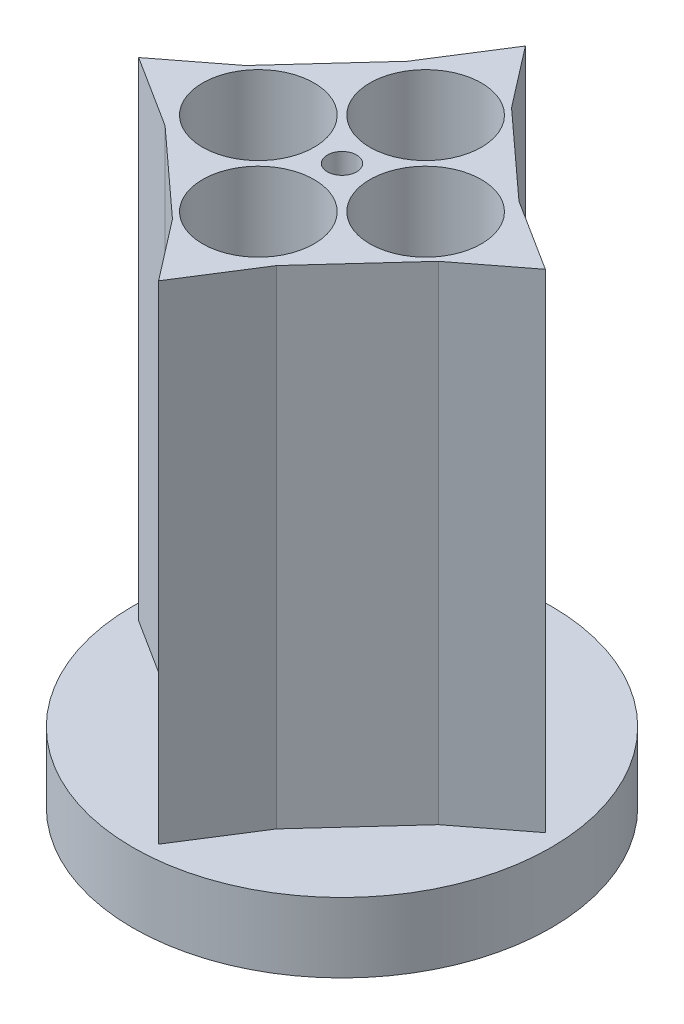
from build123d import *

# Parameters (mm, degrees)
SKETCH1_R           = 15
BOSS_EXTRUDE1_DEPTH = 40
SKETCH2_R           = 4
CUT_EXTRUDE1_DEPTH  = 7
SKETCH6_W           = 2.8
SKETCH6_H           = 1
SKETCH6_W_2         = 1
SKETCH6_H_2         = 2.8
CUT_EXTRUDE4_DEPTH  = 30
SKETCH7_R           = 9.5
CUT_EXTRUDE5_DEPTH  = 3
CUT_EXTRUDE6_REACH  = 44.65
SKETCH8_R           = 1.05
SKETCH9_R           = 3.39912378
BOSS_EXTRUDE2_DEPTH = 4
SKETCH10_R          = 2
CUT_EXTRUDE7_DEPTH  = 4
CUT_EXTRUDE9_START  = -35
SKETCH13_R          = 15
CUT_EXTRUDE9_DEPTH  = 35


with BuildPart() as part:
    # Sketch1 → Boss-Extrude1 (new body)
    with BuildSketch(Plane(origin=(0, 0, 0), x_dir=(1, 0, 0), z_dir=(0, 1, 0))):
        with Locations(Location((0, 0, 0), (0, 0, 270))):
            Circle(SKETCH1_R)
    extrude(amount=BOSS_EXTRUDE1_DEPTH)

    # Sketch2 → Cut-Extrude1 (cut)
    with BuildSketch(Plane(origin=(0, 40, 0), x_dir=(1, 0, 0), z_dir=(0, 1, 0))):
        with Locations(Location((0, 6, 0), (0, 0, 270))):
            Circle(SKETCH2_R)
        with Locations(Location((6, 0, 0), (0, 0, 270))):
            Circle(SKETCH2_R)
        with Locations(Location((0, -6, 0), (0, 0, 270))):
            Circle(SKETCH2_R)
        with Locations(Location((-6, 0, 0), (0, 0, 270))):
            Circle(SKETCH2_R)
    extrude(amount=-CUT_EXTRUDE1_DEPTH, mode=Mode.SUBTRACT)

    # Sketch6 → Cut-Extrude4 (cut)
    with BuildSketch(Plane(origin=(0, 33, 0), x_dir=(1, 0, 0), z_dir=(0, 1, 0))):
        with Locations((0, -6)):
            Rectangle(SKETCH6_W, SKETCH6_H)
        with Locations((6, 0)):
            Rectangle(SKETCH6_W_2, SKETCH6_H_2)
        with Locations((-6, 0)):
            Rectangle(SKETCH6_W_2, SKETCH6_H_2)
        with Locations((0, 6)):
            Rectangle(SKETCH6_W, SKETCH6_H)
    extrude(amount=-CUT_EXTRUDE4_DEPTH, mode=Mode.SUBTRACT)

    # Sketch7 → Cut-Extrude5 (cut)
    with BuildSketch(Plane.XZ):
        with Locations(Location((0, 0, 0), (0, 0, 270))):
            Circle(SKETCH7_R)
    extrude(amount=-CUT_EXTRUDE5_DEPTH, mode=Mode.SUBTRACT)

    # Sketch8 → Cut-Extrude6 (cut, up to next)
    with BuildSketch(Plane.XZ.offset(-3), mode=Mode.PRIVATE) as cut_extrude6_sk1:
        with Locations(Location((0, 0, 0), (0, 0, 270))):
            Circle(SKETCH8_R)
    cut_extrude6_tool1 = extrude(cut_extrude6_sk1.sketch, amount=-CUT_EXTRUDE6_REACH, mode=Mode.PRIVATE) & part.part
    add(cut_extrude6_tool1.solids().sort_by_distance((0, 3, 0))[0], mode=Mode.SUBTRACT)

    # Sketch9 → Boss-Extrude2 (add)
    with BuildSketch(Plane.XZ.offset(-3)):
        with Locations(Location((0, 0, 0), (0, 0, 270))):
            Circle(SKETCH9_R)
    extrude(amount=BOSS_EXTRUDE2_DEPTH)

    # Sketch10 → Cut-Extrude7 (cut)
    with BuildSketch(Plane.XZ.offset(1)):
        with Locations(Location((0, 0, 0), (0, 0, 270))):
            Circle(SKETCH10_R)
    extrude(amount=-CUT_EXTRUDE7_DEPTH, mode=Mode.SUBTRACT)

    # Sketch13 → Cut-Extrude9 (cut)
    with BuildSketch(Plane(origin=(0, 40, 0), x_dir=(1, 0, 0), z_dir=(0, 1, 0)).offset(CUT_EXTRUDE9_START)):
        with Locations(Location((0, 0, 0), (0, 0, 270))):
            Circle(SKETCH13_R)
        Polygon((8.693004096, 4), (13.871626361, 0.715633025), (9.540851678, -2.621495041), (4, -8.693004096), (0.715633025, -13.871626361), (-2.621495041, -9.540851678), (-8.693004096, -4), (-13.871626361, -0.715633025), (-9.540851678, 2.621495041), (-4, 8.693004096), (-0.715633025, 13.871626361), (2.621495041, 9.540851678), align=None, mode=Mode.SUBTRACT)
    extrude(amount=CUT_EXTRUDE9_DEPTH, mode=Mode.SUBTRACT)


solid = part.part
